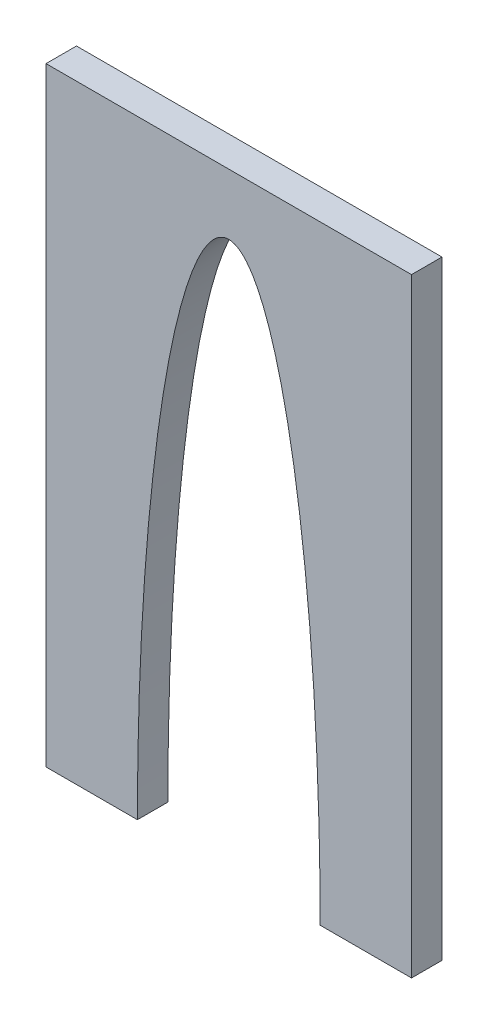
from build123d import *

# Parameters (mm, degrees)
SKIZZE1_W                       = 12
SKIZZE1_H                       = 20
AUFSATZ_LINEAR_AUSTRAGEN1_DEPTH = 1
SKIZZE2_RX                      = 18
SKIZZE2_RY                      = 3
SCHNITT_LINEAR_AUSTRAGEN1_DEPTH = 24.34523506


with BuildPart() as part:
    # Skizze1 → Aufsatz-Linear austragen1 (new body)
    with BuildSketch(Plane.XY):
        with Locations((6, 10)):
            Rectangle(SKIZZE1_W, SKIZZE1_H)
    extrude(amount=AUFSATZ_LINEAR_AUSTRAGEN1_DEPTH)

    # Skizze2 → Schnitt-Linear austragen1 (cut, through all)
    with BuildSketch(Plane(origin=(0, 0, 0), x_dir=(-1, 0, 0), z_dir=(0, 0, -1))):
        with Locations(Location((-6, 0), (0, 0, 90))):
            Ellipse(SKIZZE2_RX, SKIZZE2_RY)
    extrude(amount=-SCHNITT_LINEAR_AUSTRAGEN1_DEPTH, mode=Mode.SUBTRACT)


solid = part.part
